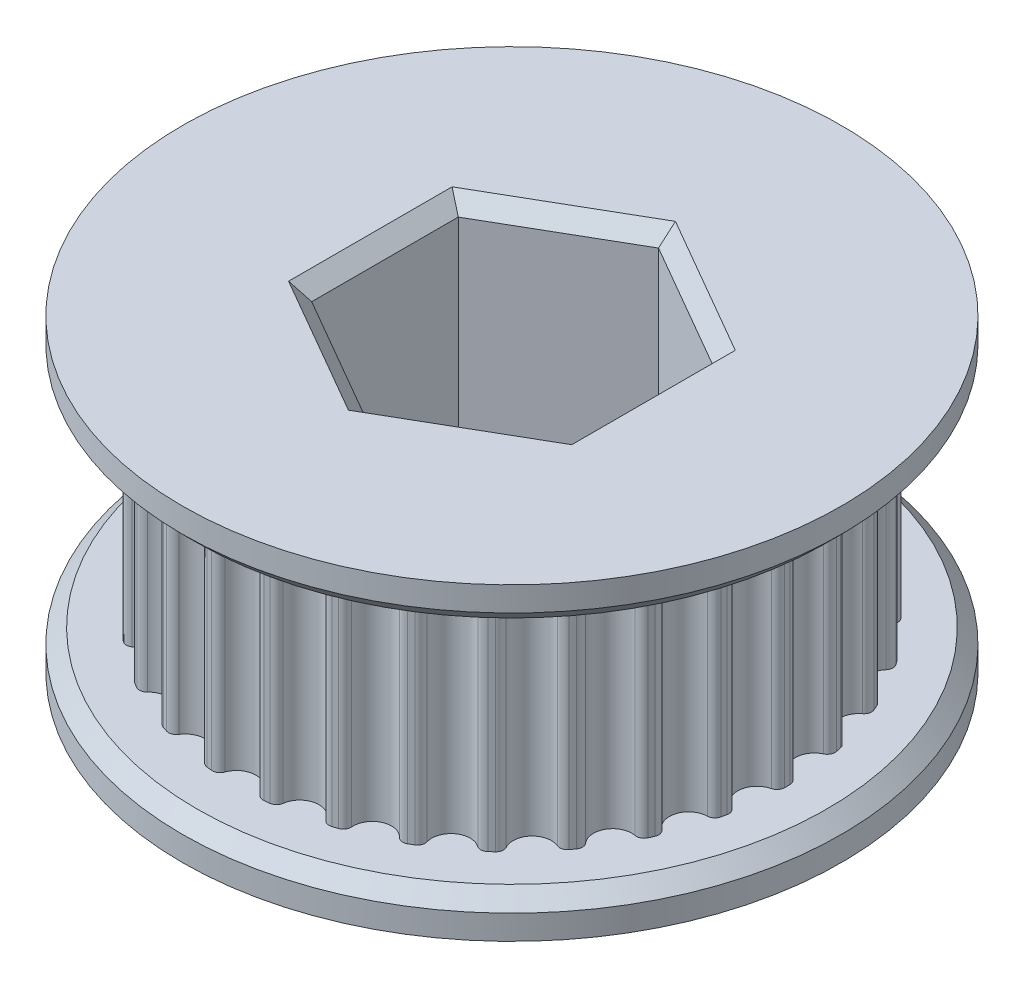
from build123d import *

# Parameters (mm, degrees)
SKETCH1_R                = 14.323944878
BOSS_EXTRUDE2_DEPTH      = 12
SKETCH1_3_R              = 1
CUT_EXTRUDE3_DEPTH       = 24.544655312
FILLET1_R                = 0.4
CIRPATTERN2_COUNT        = 30
FILLET1_OF_CIRPATTERN2_R = 0.4
SKETCH2_R                = 17.145
BOSS_EXTRUDE3_DEPTH      = 2.032
BOSS_EXTRUDE4_START      = -14.032
SKETCH2_2_R              = 17.145
BOSS_EXTRUDE4_DEPTH      = 2.032
CUT_EXTRUDE4_DEPTH       = 29.014265667
CHAMFER1_SIZE            = 0.762
CHAMFER2_SIZE            = 0.762


with BuildPart() as part:
    # Sketch1 → Boss-Extrude2 (new body)
    with BuildSketch(Plane(origin=(0, 0, 0), x_dir=(1, 0, 0), z_dir=(0, 1, 0))):
        with Locations(Location((0, 0, 0), (0, 0, 270))):
            Circle(SKETCH1_R)
    extrude(amount=BOSS_EXTRUDE2_DEPTH)

    # Sketch1<3> → Cut-Extrude3 (cut, symmetric)
    with BuildSketch(Plane(origin=(0, 0, 0), x_dir=(1, 0, 0), z_dir=(0, 1, 0))):
        with Locations((0, 14.323944878)):
            Circle(SKETCH1_3_R)
    cut_extrude3 = extrude(amount=CUT_EXTRUDE3_DEPTH, both=True, mode=Mode.SUBTRACT)

    # Fillet1
    fillet1_edges = [part.edges().sort_by_distance(p)[0] for p in [
        (0.999390579, 6, -14.289038293),
        (-0.999390579, 6, -14.289038293),
    ]]
    fillet(fillet1_edges, radius=FILLET1_R)

    # CirPattern2: Cut-Extrude3 ×30 about axis
    cirpattern2_axis = Axis((0, 0, 0), (0, 1, 0))
    for i in range(1, CIRPATTERN2_COUNT):
        add(cut_extrude3.rotate(cirpattern2_axis, i * 360 / CIRPATTERN2_COUNT), mode=Mode.SUBTRACT)

    # Fillet1 of CirPattern2
    fillet1_of_cirpattern2_edges = [part.edges().sort_by_distance(p)[0] for p in [
        (-1.993306614, 6, -14.184573508),
        (-3.948409609, 6, -13.769003538),
        (-4.898886744, 6, -13.460174796),
        (-6.724864192, 6, -12.647197257),
        (-7.590362015, 6, -12.147501856),
        (-9.207409941, 6, -10.972647769),
        (-9.950102044, 6, -10.303924795),
        (-11.287547693, 6, -8.81854092),
        (-11.874974868, 6, -8.010016777),
        (-12.874365447, 6, -6.279021516),
        (-13.280854307, 6, -5.366032589),
        (-13.898511653, 6, -3.465078743),
        (-14.106296685, 6, -2.487527028),
        (-14.315226208, 6, -0.499695401),
        (-14.315226208, 6, 0.499695401),
        (-14.106296685, 6, 2.487527028),
        (-13.898511653, 6, 3.465078743),
        (-13.280854307, 6, 5.366032589),
        (-12.874365447, 6, 6.279021516),
        (-11.874974868, 6, 8.010016777),
        (-11.287547693, 6, 8.81854092),
        (-9.950102044, 6, 10.303924795),
        (-9.207409941, 6, 10.972647769),
        (-7.590362015, 6, 12.147501856),
        (-6.724864192, 6, 12.647197257),
        (-4.898886744, 6, 13.460174796),
        (-3.948409609, 6, 13.769003538),
        (-1.993306614, 6, 14.184573508),
        (-0.999390579, 6, 14.289038293),
        (0.999390579, 6, 14.289038293),
        (1.993306614, 6, 14.184573508),
        (3.948409609, 6, 13.769003538),
        (4.898886744, 6, 13.460174796),
        (6.724864192, 6, 12.647197257),
        (7.590362015, 6, 12.147501856),
        (9.207409941, 6, 10.972647769),
        (9.950102044, 6, 10.303924795),
        (11.287547693, 6, 8.81854092),
        (11.874974868, 6, 8.010016777),
        (12.874365447, 6, 6.279021516),
        (13.280854307, 6, 5.366032589),
        (13.898511653, 6, 3.465078743),
        (14.106296685, 6, 2.487527028),
        (14.315226208, 6, 0.499695401),
        (14.315226208, 6, -0.499695401),
        (14.106296685, 6, -2.487527028),
        (13.898511653, 6, -3.465078743),
        (13.280854307, 6, -5.366032589),
        (12.874365447, 6, -6.279021516),
        (11.874974868, 6, -8.010016777),
        (11.287547693, 6, -8.81854092),
        (9.950102044, 6, -10.303924795),
        (9.207409941, 6, -10.972647769),
        (7.590362015, 6, -12.147501856),
        (6.724864192, 6, -12.647197257),
        (4.898886744, 6, -13.460174796),
        (3.948409609, 6, -13.769003538),
        (1.993306614, 6, -14.184573508),
    ]]
    fillet(fillet1_of_cirpattern2_edges, radius=FILLET1_OF_CIRPATTERN2_R)

    # Sketch2 → Boss-Extrude3 (add)
    with BuildSketch(Plane(origin=(0, 12, 0), x_dir=(1, 0, 0), z_dir=(0, 1, 0))):
        with Locations(Location((0, 0, 0), (0, 0, 270))):
            Circle(SKETCH2_R)
        Polygon((-6.604, -3.812821178), (0, -7.625642355), (6.604, -3.812821178), (6.604, 3.812821178), (0, 7.625642355), (-6.604, 3.812821178), align=None, mode=Mode.SUBTRACT)
    extrude(amount=BOSS_EXTRUDE3_DEPTH)

    # Sketch2<2> → Boss-Extrude4 (add)
    with BuildSketch(Plane(origin=(0, 12, 0), x_dir=(1, 0, 0), z_dir=(0, 1, 0)).offset(BOSS_EXTRUDE4_START)):
        with Locations(Location((0, 0, 0), (0, 0, 270))):
            Circle(SKETCH2_2_R)
        Polygon((-6.604, -3.812821178), (0, -7.625642355), (6.604, -3.812821178), (6.604, 3.812821178), (0, 7.625642355), (-6.604, 3.812821178), align=None, mode=Mode.SUBTRACT)
    extrude(amount=BOSS_EXTRUDE4_DEPTH)

    # Sketch2<3> → Cut-Extrude4 (cut, through all)
    with BuildSketch(Plane(origin=(0, 12, 0), x_dir=(1, 0, 0), z_dir=(0, 1, 0))):
        Polygon((0, 7.625642355), (-6.604, 3.812821178), (-6.604, -3.812821178), (0, -7.625642355), (6.604, -3.812821178), (6.604, 3.812821178), align=None)
    extrude(amount=-CUT_EXTRUDE4_DEPTH, mode=Mode.SUBTRACT)

    # Chamfer1
    chamfer1_edges = [part.edges().sort_by_distance(p)[0] for p in [
        (-6.604, 14.032, 0),
        (-3.302, 14.032, 5.719231767),
        (3.302, 14.032, 5.719231767),
        (6.604, 14.032, 0),
        (3.302, 14.032, -5.719231767),
        (-3.302, 14.032, -5.719231767),
        (-3.302, -2.032, -5.719231767),
        (-6.604, -2.032, 0),
        (-3.302, -2.032, 5.719231767),
        (3.302, -2.032, 5.719231767),
        (6.604, -2.032, 0),
        (3.302, -2.032, -5.719231767),
    ]]
    chamfer(chamfer1_edges, length=CHAMFER1_SIZE)

    # Chamfer2
    chamfer2_edges = [part.edges().sort_by_distance(p)[0] for p in [
        (0, 12, -17.145),
        (0, 0, -17.145),
    ]]
    chamfer(chamfer2_edges, length=CHAMFER2_SIZE)


solid = part.part
